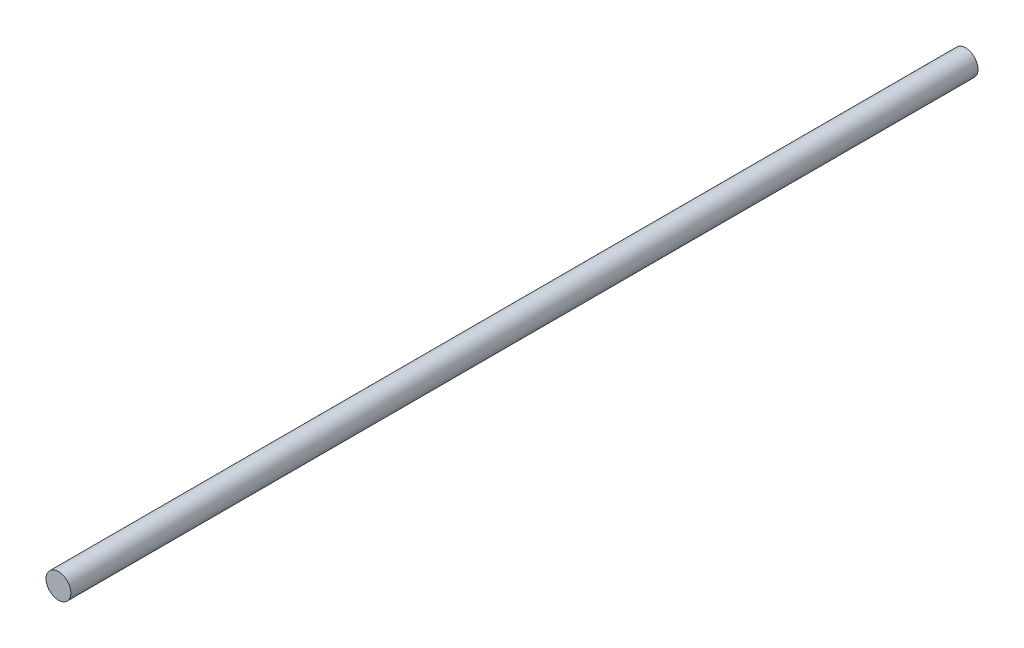
from build123d import *

# Parameters (mm, degrees)
SKETCH_1_R      = 10
EXTRUDE_1_DEPTH = 730


with BuildPart() as part:
    # 草图1 → 凸台-拉伸1 (new body)
    with BuildSketch(Plane.XY):
        with Locations(Location((0, 0, 0), (0, 0, 180))):
            Circle(SKETCH_1_R)
    extrude(amount=EXTRUDE_1_DEPTH)


solid = part.part
